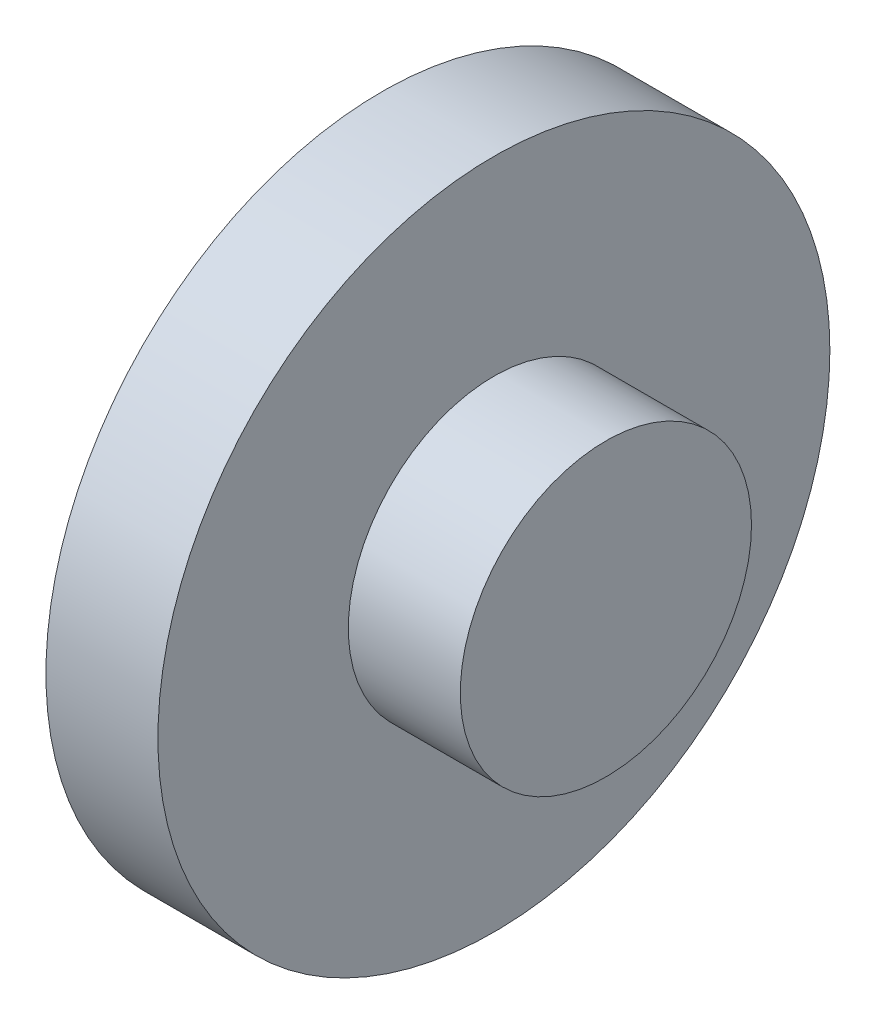
from build123d import *

# Parameters (mm, degrees)
SKETCH_1_R      = 30
EXTRUDE_1_DEPTH = 10
SKETCH_2_R      = 13
EXTRUDE_2_DEPTH = 10


with BuildPart() as part:
    # 草图1 → 凸台-拉伸1 (new body)
    with BuildSketch(Plane(origin=(0, 0, 0), x_dir=(0, 0, -1), z_dir=(1, 0, 0))):
        Circle(SKETCH_1_R)
    extrude(amount=EXTRUDE_1_DEPTH)

    # 草图2 → 凸台-拉伸2 (add)
    with BuildSketch(Plane(origin=(10, 0, 0), x_dir=(0, 0, -1), z_dir=(1, 0, 0))):
        Circle(SKETCH_2_R)
    extrude(amount=EXTRUDE_2_DEPTH)


solid = part.part
